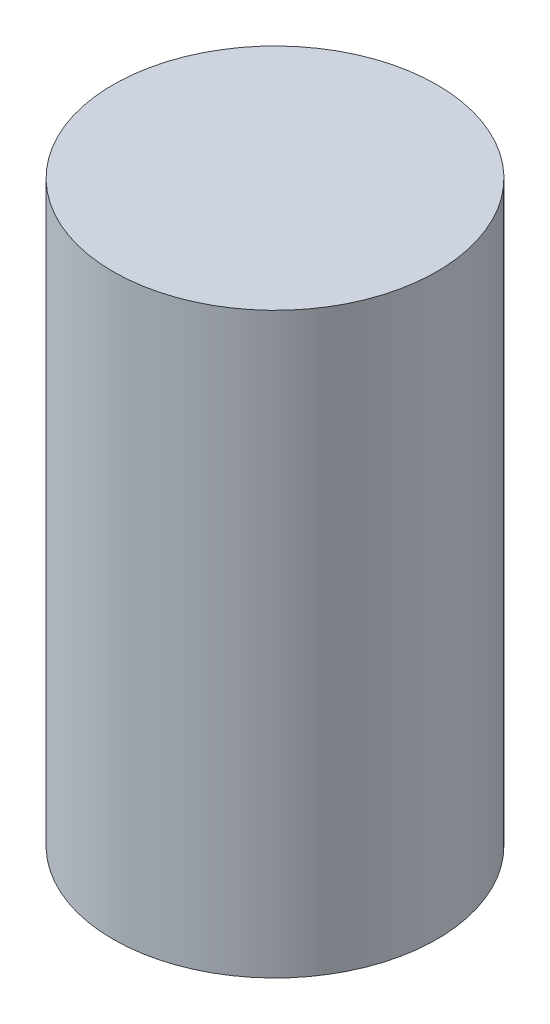
from build123d import *

# Parameters (mm, degrees)
SKETCH_1_R      = 7
EXTRUDE_1_DEPTH = 20
SKETCH_4_R      = 7
EXTRUDE_2_DEPTH = 5


with BuildPart() as part:
    # 草图1 → 凸台-拉伸1 (new body)
    with BuildSketch(Plane(origin=(0, 0, 0), x_dir=(1, 0, 0), z_dir=(0, 1, 0))):
        with Locations(Location((0, 0, 0), (0, 0, 270))):
            Circle(SKETCH_1_R)
    extrude(amount=EXTRUDE_1_DEPTH)

    # 草图4 → 凸台-拉伸2 (add)
    with BuildSketch(Plane(origin=(0, 20, 0), x_dir=(1, 0, 0), z_dir=(0, 1, 0))):
        with Locations(Location((0, 0, 0), (0, 0, 270))):
            Circle(SKETCH_4_R)
    extrude(amount=EXTRUDE_2_DEPTH)


solid = part.part
